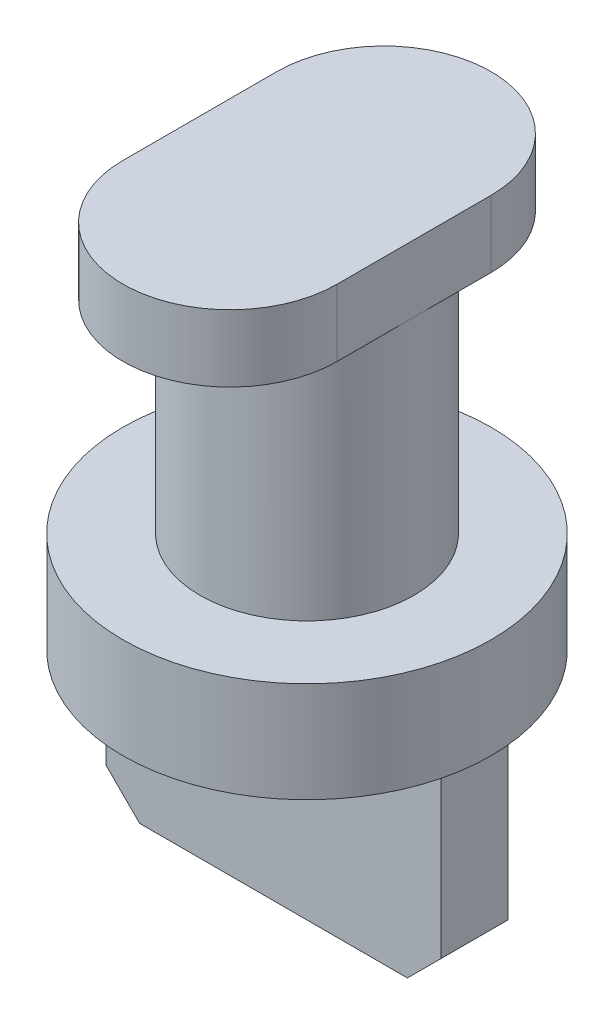
from build123d import *

# Parameters (mm, degrees)
EXTRUDE_1_DEPTH = 0.5
SKETCH_3_R      = 2.75
EXTRUDE_2_DEPTH = 1.5
SKETCH_5_R      = 1.6
EXTRUDE_3_DEPTH = 3.6
EXTRUDE_4_DEPTH = 1


with BuildPart() as part:
    # ｽｹｯﾁ2 → ﾎﾞｽ - 押し出し1 (new, symmetric)
    with BuildSketch(Plane.XY):
        Polygon((-2, 0), (2, 0), (2.5, 0.5), (2.5, 3), (-2.5, 3), (-2.5, 0.5), align=None)
    extrude(amount=EXTRUDE_1_DEPTH, both=True)

    # ｽｹｯﾁ3 → ﾎﾞｽ - 押し出し2 (add)
    with BuildSketch(Plane(origin=(0, 3, 0), x_dir=(1, 0, 0), z_dir=(0, 1, 0))):
        with Locations(Location((0, 0, 0), (0, 0, 270))):
            Circle(SKETCH_3_R)
    extrude(amount=EXTRUDE_2_DEPTH)

    # ｽｹｯﾁ5 → ﾎﾞｽ - 押し出し3 (add)
    with BuildSketch(Plane(origin=(0, 4.5, 0), x_dir=(1, 0, 0), z_dir=(0, 1, 0))):
        with Locations(Location((0, 0, 0), (0, 0, 270))):
            Circle(SKETCH_5_R)
    extrude(amount=EXTRUDE_3_DEPTH)

    # ｽｹｯﾁ6 → ﾎﾞｽ - 押し出し4 (add)
    with BuildSketch(Plane(origin=(0, 8.1, 0), x_dir=(1, 0, 0), z_dir=(0, 1, 0))):
        with BuildLine():
            Line((-1.6, -1.15), (-1.6, 1.15))
            ThreePointArc((-1.6, 1.15), (0, 2.75), (1.6, 1.15))
            Line((1.6, 1.15), (1.6, -1.15))
            ThreePointArc((1.6, -1.15), (0, -2.75), (-1.6, -1.15))
        make_face()
    extrude(amount=EXTRUDE_4_DEPTH)


solid = part.part
